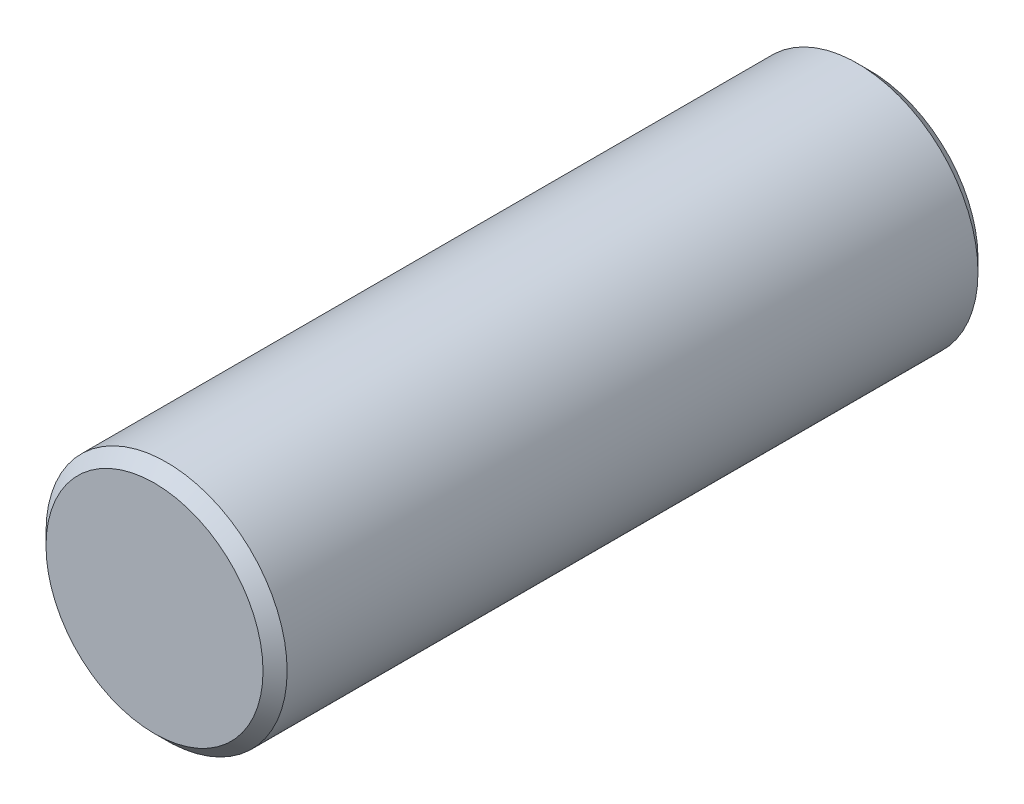
from build123d import *

# Parameters (mm, degrees)
SKETCH3_R           = 5
BOSS_EXTRUDE1_DEPTH = 29.65
CHAMFER1_SIZE       = 0.5


with BuildPart() as part:
    # Sketch3 → Boss-Extrude1 (new body)
    with BuildSketch(Plane.XY):
        with Locations(Location((0, 0, 0), (0, 0, 180))):
            Circle(SKETCH3_R)
    extrude(amount=BOSS_EXTRUDE1_DEPTH)

    # Chamfer1
    chamfer1_edges = [part.edges().sort_by_distance(p)[0] for p in [
        (5, 0, 0),
        (5, 0, 29.65),
    ]]
    chamfer(chamfer1_edges, length=CHAMFER1_SIZE)


solid = part.part
